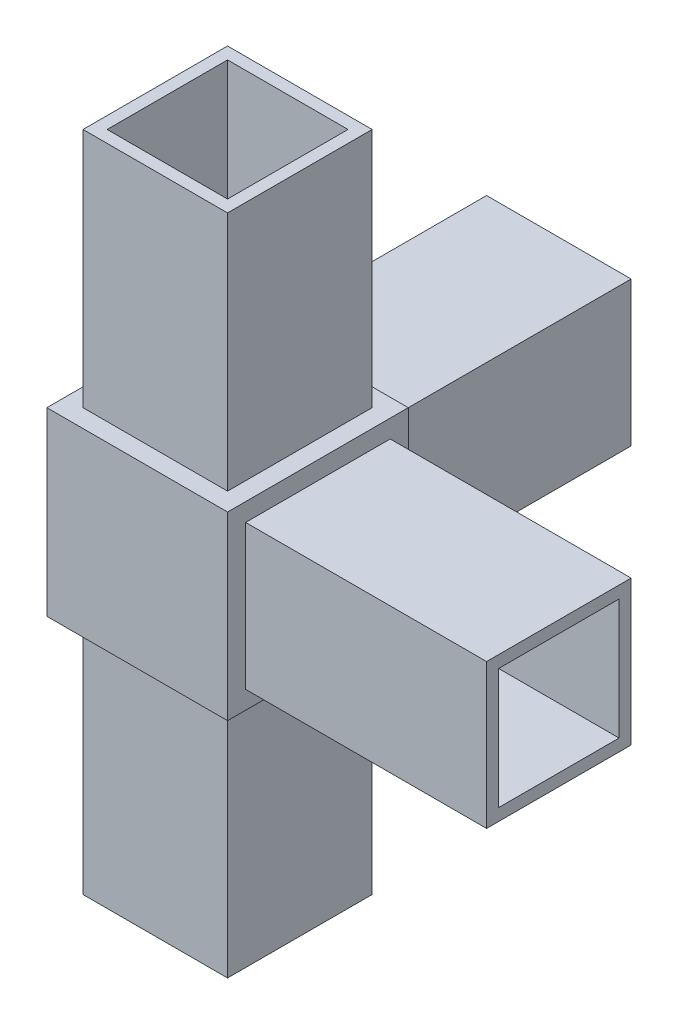
from build123d import *

# Parameters (mm, degrees)
CROQUIS1_W     = 30
CROQUIS1_H     = 40
CROQUIS1_H_2   = 30
CROQUIS1_W_2   = 40
EXTRUIR1_DEPTH = 30
CROQUIS5_W     = 30
CROQUIS5_H     = 30
EXTRUIR4_DEPTH = 40
CROQUIS8_W     = 30
CROQUIS8_H     = 30
EXTRUIR6_DEPTH = 40
CROQUIS9_W     = 30
CROQUIS9_H     = 30
CROQUIS9_W_2   = 24
CROQUIS9_H_2   = 24
EXTRUIR7_DEPTH = 40
CROQUIS2_W     = 30
CROQUIS2_H     = 30
CROQUIS2_W_2   = 24
CROQUIS2_H_2   = 24
EXTRUIR2_DEPTH = 40
CROQUIS3_W     = 30
CROQUIS3_H     = 30
CROQUIS3_W_2   = 24
CROQUIS3_H_2   = 24
EXTRUIR3_DEPTH = 40
CROQUIS7_W     = 30
CROQUIS7_H     = 30
CROQUIS7_W_2   = 24
CROQUIS7_H_2   = 24
EXTRUIR5_DEPTH = 40
VACIADO1_T     = -2


with BuildPart() as part:
    # Croquis1 → Extruir1 (new body)
    with BuildSketch(Plane(origin=(0, 0, 0), x_dir=(1, 0, 0), z_dir=(0, 1, 0))):
        with Locations((0, 35)):
            Rectangle(CROQUIS1_W, CROQUIS1_H)
        Rectangle(CROQUIS1_W, CROQUIS1_H_2)
        with Locations((35, 0)):
            Rectangle(CROQUIS1_W_2, CROQUIS1_H_2)
    extrude(amount=EXTRUIR1_DEPTH)

    # Croquis5 → Extruir4 (add)
    with BuildSketch(Plane.XZ):
        Rectangle(CROQUIS5_W, CROQUIS5_H)
    extrude(amount=EXTRUIR4_DEPTH)

    # Croquis8 → Extruir6 (add)
    with BuildSketch(Plane(origin=(0, 30, 0), x_dir=(1, 0, 0), z_dir=(0, 1, 0))):
        Rectangle(CROQUIS8_W, CROQUIS8_H)
    extrude(amount=EXTRUIR6_DEPTH)

    # Croquis9 → Extruir7 (cut)
    with BuildSketch(Plane(origin=(0, 70, 0), x_dir=(1, 0, 0), z_dir=(0, 1, 0))):
        Rectangle(CROQUIS9_W, CROQUIS9_H)
        Rectangle(CROQUIS9_W_2, CROQUIS9_H_2, mode=Mode.SUBTRACT)
    extrude(amount=-EXTRUIR7_DEPTH, mode=Mode.SUBTRACT)

    # Croquis2 → Extruir2 (cut)
    with BuildSketch(Plane(origin=(55, 0, 0), x_dir=(0, 0, -1), z_dir=(1, 0, 0))):
        with Locations((0, 15)):
            Rectangle(CROQUIS2_W, CROQUIS2_H)
        with Locations((0, 15)):
            Rectangle(CROQUIS2_W_2, CROQUIS2_H_2, mode=Mode.SUBTRACT)
    extrude(amount=-EXTRUIR2_DEPTH, mode=Mode.SUBTRACT)

    # Croquis3 → Extruir3 (cut)
    with BuildSketch(Plane(origin=(0, 0, -55), x_dir=(-1, 0, 0), z_dir=(0, 0, -1))):
        with Locations((0, 15)):
            Rectangle(CROQUIS3_W, CROQUIS3_H)
        with Locations((0, 15)):
            Rectangle(CROQUIS3_W_2, CROQUIS3_H_2, mode=Mode.SUBTRACT)
    extrude(amount=-EXTRUIR3_DEPTH, mode=Mode.SUBTRACT)

    # Croquis7 → Extruir5 (cut)
    with BuildSketch(Plane.XZ.offset(40)):
        Rectangle(CROQUIS7_W, CROQUIS7_H)
        Rectangle(CROQUIS7_W_2, CROQUIS7_H_2, mode=Mode.SUBTRACT)
    extrude(amount=-EXTRUIR5_DEPTH, mode=Mode.SUBTRACT)

    # Vaciado1
    vaciado1_openings = [part.faces().sort_by_distance(p)[0] for p in [
        (0, 15, -55),
        (0, -40, 0),
        (0, 70, 0),
        (55, 15, 0),
    ]]
    offset(amount=VACIADO1_T, openings=vaciado1_openings, kind=Kind.INTERSECTION)


solid = part.part
